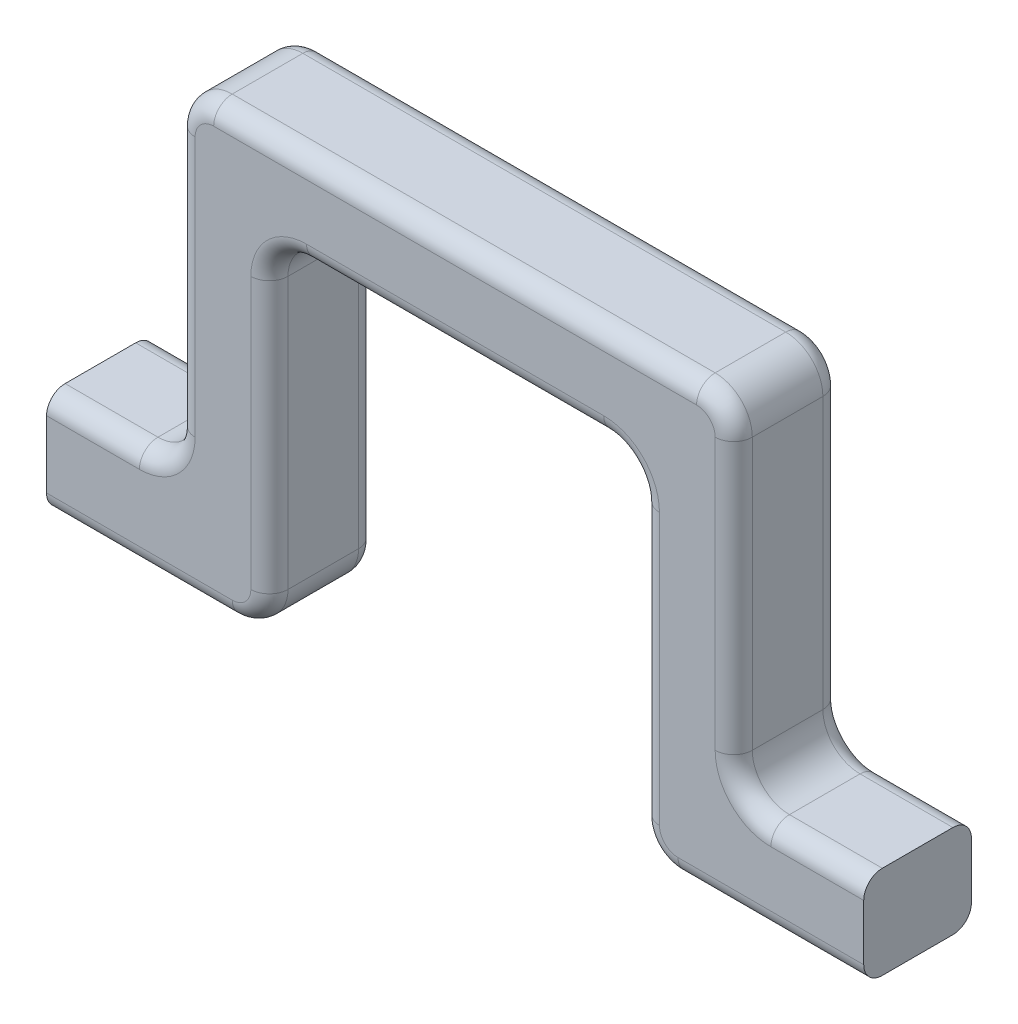
from build123d import *

# Parameters (mm, degrees)
SKETCH3_W           = 29
SKETCH3_H           = 28
BOSS_EXTRUDE2_DEPTH = 60
SKETCH4_W           = 25
SKETCH4_H           = 29
BOSS_EXTRUDE3_DEPTH = 90
SKETCH5_W           = 29
SKETCH5_H           = 25
BOSS_EXTRUDE4_DEPTH = 125
SKETCH7_W           = 25
SKETCH7_H           = 29
BOSS_EXTRUDE5_DEPTH = 93
SKETCH8_W           = 29
SKETCH8_H           = 25
BOSS_EXTRUDE6_DEPTH = 35
FILLET1_R           = 10
FILLET2_R           = 10
FILLET3_R           = 5


with BuildPart() as part:
    # Sketch3 → Boss-Extrude2 (new body)
    with BuildSketch(Plane(origin=(0, 0, 0), x_dir=(0, 0, -1), z_dir=(1, 0, 0))):
        Rectangle(SKETCH3_W, SKETCH3_H)
    extrude(amount=BOSS_EXTRUDE2_DEPTH)

    # Sketch4 → Boss-Extrude3 (add)
    with BuildSketch(Plane(origin=(0, 14, 0), x_dir=(1, 0, 0), z_dir=(0, 1, 0))):
        with Locations((47.5, 0)):
            Rectangle(SKETCH4_W, SKETCH4_H)
    extrude(amount=BOSS_EXTRUDE3_DEPTH)

    # Sketch5 → Boss-Extrude4 (add)
    with BuildSketch(Plane(origin=(60, 0, 0), x_dir=(0, 0, -1), z_dir=(1, 0, 0))):
        with Locations((0, 91.5)):
            Rectangle(SKETCH5_W, SKETCH5_H)
    extrude(amount=BOSS_EXTRUDE4_DEPTH)

    # Sketch7 → Boss-Extrude5 (add)
    with BuildSketch(Plane.XZ.offset(-79)):
        with Locations((172.5, 0)):
            Rectangle(SKETCH7_W, SKETCH7_H)
    extrude(amount=BOSS_EXTRUDE5_DEPTH)

    # Sketch8 → Boss-Extrude6 (add)
    with BuildSketch(Plane(origin=(185, 0, 0), x_dir=(0, 0, -1), z_dir=(1, 0, 0))):
        with Locations((0, -1.5)):
            Rectangle(SKETCH8_W, SKETCH8_H)
    extrude(amount=BOSS_EXTRUDE6_DEPTH)

    # Fillet1
    fillet1_edges = [part.edges().sort_by_distance(p)[0] for p in [
        (35, 14, 0),
        (35, 104, 0),
        (185, 104, 0),
        (160, 79, 0),
        (185, 11, 0),
    ]]
    fillet(fillet1_edges, radius=FILLET1_R)

    # Fillet2
    fillet2_edges = [part.edges().sort_by_distance(p)[0] for p in [
        (60, 79, 0),
        (160, -14, 0),
        (60, -14, 0),
    ]]
    fillet(fillet2_edges, radius=FILLET2_R)

    # Fillet3
    fillet3_edges = [part.edges().sort_by_distance(p)[0] for p in [
        (60, 32.5, 14.5),
        (60, 32.5, -14.5),
        (195, -14, -14.5),
        (160, 32.5, -14.5),
        (25, -14, -14.5),
        (162.928932188, -11.071067812, -14.5),
        (57.071067812, -11.071067812, -14.5),
        (25, -14, 14.5),
        (160, 32.5, 14.5),
        (162.928932188, -11.071067812, 14.5),
        (57.071067812, -11.071067812, 14.5),
        (62.928932188, 76.071067812, -14.5),
        (62.928932188, 76.071067812, 14.5),
        (195, -14, 14.5),
        (207.5, 11, -14.5),
        (207.5, 11, 14.5),
        (110, 79, 14.5),
        (110, 79, -14.5),
        (35, 59, 14.5),
        (35, 59, -14.5),
        (12.5, 14, -14.5),
        (12.5, 14, 14.5),
        (110, 104, 14.5),
        (110, 104, -14.5),
        (185, 57.5, 14.5),
        (182.071067812, 101.071067812, 14.5),
        (37.928932188, 101.071067812, 14.5),
        (185, 57.5, -14.5),
        (182.071067812, 101.071067812, -14.5),
        (37.928932188, 101.071067812, -14.5),
        (157.071067812, 76.071067812, -14.5),
        (157.071067812, 76.071067812, 14.5),
        (32.071067812, 16.928932188, 14.5),
        (32.071067812, 16.928932188, -14.5),
        (187.928932188, 13.928932188, 14.5),
        (187.928932188, 13.928932188, -14.5),
    ]]
    fillet(fillet3_edges, radius=FILLET3_R)


solid = part.part
